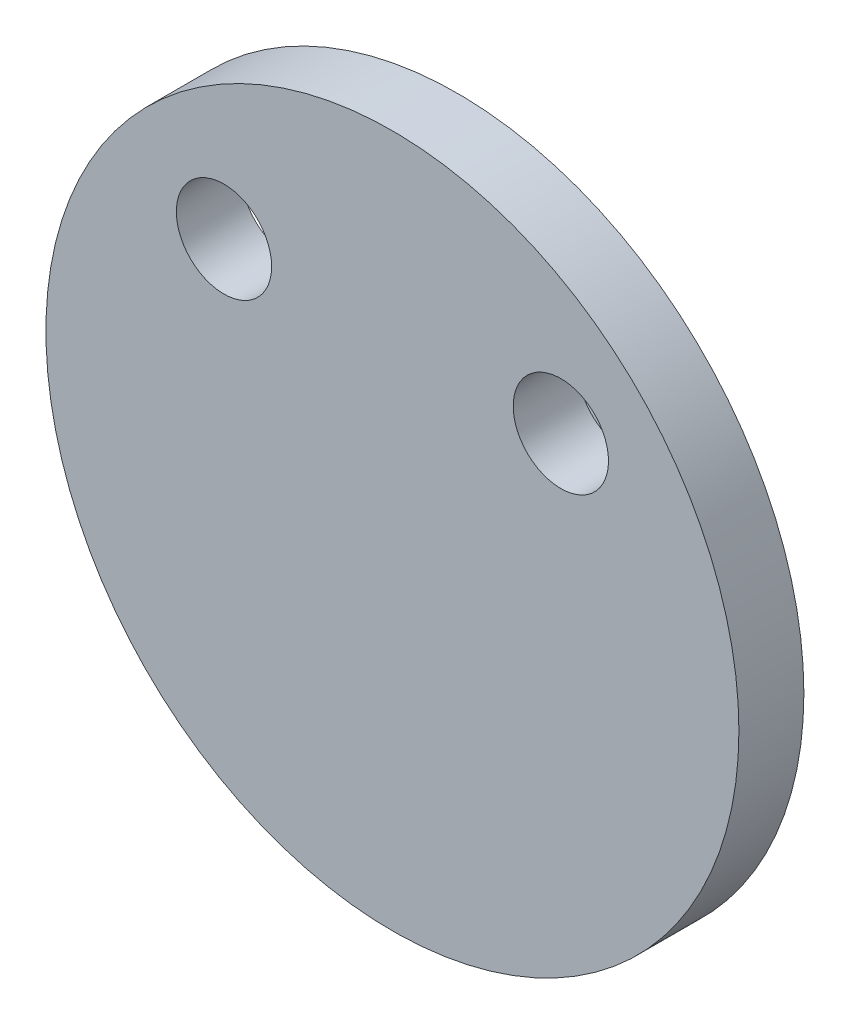
from build123d import *

# Parameters (mm, degrees)
ESQUISSE1_R              = 8
ESQUISSE1_R_2            = 1.1
DISQUE_O16_DEPTH         = 1.5
ESQUISSE2_R              = 3.5
ESQUISSE2_R_2            = 2.35
MOYEU_CANNELE_SG90_DEPTH = 3


with BuildPart() as part:
    # Esquisse1 → Disque O16 (new body)
    with BuildSketch(Plane.XY):
        Circle(ESQUISSE1_R)
        with Locations((3.889087297, 3.889087297)):
            Circle(ESQUISSE1_R_2, mode=Mode.SUBTRACT)
        with Locations((-3.889087297, 3.889087297)):
            Circle(ESQUISSE1_R_2, mode=Mode.SUBTRACT)
    extrude(amount=DISQUE_O16_DEPTH)

    # Esquisse2 → Moyeu cannele SG90 (add)
    with BuildSketch(Plane.XY):
        Circle(ESQUISSE2_R)
        Circle(ESQUISSE2_R_2, mode=Mode.SUBTRACT)
    extrude(amount=-MOYEU_CANNELE_SG90_DEPTH)


solid = part.part
